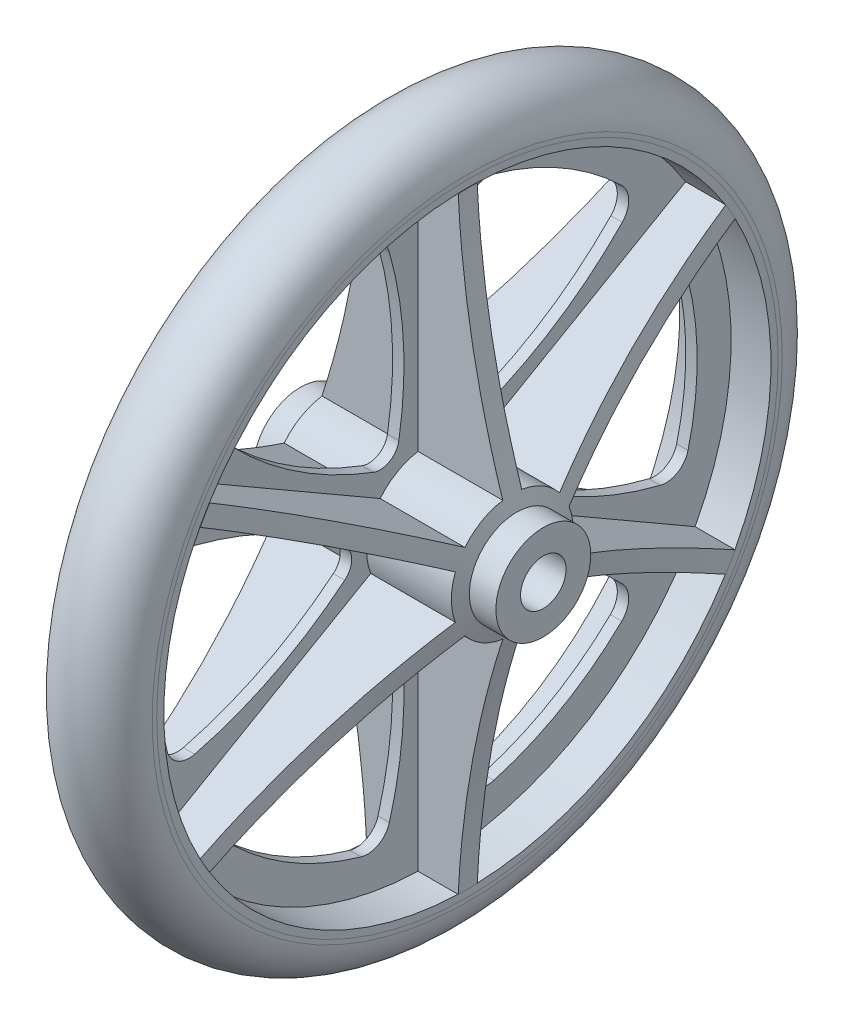
from build123d import *
from build123d.topology import SkipClean

# Parameters (mm, degrees)
SALIENTE_EXTRUIR8_DEPTH      = 32
SALIENTE_EXTRUIR8_DEPTH_BACK = 32
CROQUIS9_R                   = 16
CROQUIS9_R_2                 = 6
CROQUIS10_R                  = 16
CROQUIS10_R_2                = 12.5
CORTAR_EXTRUIR1_DEPTH        = 9
CROQUIS11_R                  = 16
CROQUIS11_R_2                = 12.5
CORTAR_EXTRUIR2_DEPTH        = 9
SALIENTE_EXTRUIR9_DEPTH      = 25
CROQUIS18_R                  = 80
SALIENTE_EXTRUIR10_DEPTH     = 1.5
CORTAR_EXTRUIR6_DEPTH        = 1.5
CORTAR_EXTRUIR5_DEPTH        = 100
CORTAR_EXTRUIR5_DEPTH_BACK   = 106
CROQUIS17_W                  = 44.792111463
CROQUIS17_H                  = 206.490346826
CROQUIS20_R                  = 6
CORTAR_EXTRUIR7_DEPTH        = 80


with BuildPart() as part:
    # Croquis1 → Revolución1 (revolve)
    with BuildSketch(Plane.XY, mode=Mode.PRIVATE) as revoluci_n1_sk:
        with BuildLine():
            Line((12, 80), (-12, 80))
            Line((-12, 80), (-12, 82))
            ThreePointArc((-12, 82), (0, 94), (12, 82))
            Line((12, 82), (12, 80))
        make_face()
    revolve(revoluci_n1_sk.sketch.rotate(Axis((0, 0, 0), (-1, 0, 0)), 90), axis=Axis((0, 0, 0), (-1, 0, 0)))



with BuildPart() as body_2:
    # Croquis9 → Saliente-Extruir8 (new, two sides: drawn at the far end of the back side and taken through both)
    with BuildSketch(Plane(origin=(0, 0, 0), x_dir=(0, 0, -1), z_dir=(1, 0, 0)).offset(-SALIENTE_EXTRUIR8_DEPTH_BACK)):
        Circle(CROQUIS9_R)
        Circle(CROQUIS9_R_2, mode=Mode.SUBTRACT)
    extrude(amount=SALIENTE_EXTRUIR8_DEPTH + SALIENTE_EXTRUIR8_DEPTH_BACK)

    # Croquis10 → Cortar-Extruir1 (cut)
    with BuildSketch(Plane(origin=(32, 0, 0), x_dir=(0, 0, -1), z_dir=(1, 0, 0))):
        Circle(CROQUIS10_R)
        Circle(CROQUIS10_R_2, mode=Mode.SUBTRACT)
    extrude(amount=-CORTAR_EXTRUIR1_DEPTH, mode=Mode.SUBTRACT)

    # Croquis11 → Cortar-Extruir2 (cut)
    with BuildSketch(Plane.ZY.offset(32)):
        with Locations(Location((0, 0, 0), (0, 0, 180))):
            Circle(CROQUIS11_R)
        with Locations(Location((0, 0, 0), (0, 0, 180))):
            Circle(CROQUIS11_R_2, mode=Mode.SUBTRACT)
    extrude(amount=-CORTAR_EXTRUIR2_DEPTH, mode=Mode.SUBTRACT)


with BuildPart() as part_1:
    add(part.part)

    add(body_2.part)  # Saliente-Extruir9 merges body 2
    # Croquis12 → Saliente-Extruir9 (add)
    with BuildSketch(Plane(origin=(0, 0, 0), x_dir=(0, 0, -1), z_dir=(1, 0, 0))):
        with BuildLine():
            ThreePointArc((70.498194922, 37.81540047), (69.282032303, 40), (67.998194922, 42.145527489))
            Line((67.998194922, 42.145527489), (12.476009193, 10.089778612))
            ThreePointArc((12.476009193, 10.089778612), (8.022693404, 13.895712589), (2.5, 15.849430205))
            Line((2.5, 15.849430205), (2.5, 79.960927959))
            ThreePointArc((2.5, 79.960927959), (0, 80), (-2.5, 79.960927959))
            Line((-2.5, 79.960927959), (-2.5, 15.849430205))
            ThreePointArc((-2.5, 15.849430205), (-8.022693404, 13.895712589), (-12.476009193, 10.089778612))
            Line((-12.476009193, 10.089778612), (-67.998194922, 42.145527489))
            ThreePointArc((-67.998194922, 42.145527489), (-69.282032303, 40), (-70.498194922, 37.81540047))
            Line((-70.498194922, 37.81540047), (-14.976009193, 5.759651593))
            ThreePointArc((-14.976009193, 5.759651593), (-16.045386808, 0), (-14.976009193, -5.759651593))
            Line((-14.976009193, -5.759651593), (-70.498194922, -37.81540047))
            ThreePointArc((-70.498194922, -37.81540047), (-69.282032303, -40), (-67.998194922, -42.145527489))
            Line((-67.998194922, -42.145527489), (-12.476009193, -10.089778612))
            ThreePointArc((-12.476009193, -10.089778612), (-8.022693404, -13.895712589), (-2.5, -15.849430205))
            Line((-2.5, -15.849430205), (-2.5, -79.960927959))
            ThreePointArc((-2.5, -79.960927959), (0, -80), (2.5, -79.960927959))
            Line((2.5, -79.960927959), (2.5, -15.849430205))
            ThreePointArc((2.5, -15.849430205), (8.022693404, -13.895712589), (12.476009193, -10.089778612))
            Line((12.476009193, -10.089778612), (67.998194922, -42.145527489))
            ThreePointArc((67.998194922, -42.145527489), (69.282032303, -40), (70.498194922, -37.81540047))
            Line((70.498194922, -37.81540047), (14.976009193, -5.759651593))
            ThreePointArc((14.976009193, -5.759651593), (16.045386808, 0), (14.976009193, 5.759651593))
            Line((14.976009193, 5.759651593), (70.498194922, 37.81540047))
        make_face()
    extrude(amount=SALIENTE_EXTRUIR9_DEPTH)

    # Croquis15 → Cortar-Revolución3 (revolve, cut)
    with BuildSketch(Plane(origin=(0, 0, 0.669872981), x_dir=(1, 0, 0), z_dir=(0, -1, 0))):
        with BuildLine():
            Line((12.957435965, -68.668067903), (25, -68.668067903))
            Line((25, -68.668067903), (25, -13.169872981))
            ThreePointArc((25, -13.169872981), (17.362483952, -40.568263508), (12.957435965, -68.668067903))
        make_face()
        with BuildLine():
            Line((25, -83.692548192), (25, -68.668067903))
            Line((25, -68.668067903), (12.957435965, -68.668067903))
            ThreePointArc((12.957435965, -68.668067903), (12.341238653, -76.172602145), (11.956342895, -83.692548192))
            Line((11.956342895, -83.692548192), (25, -83.692548192))
        make_face()
    revolve(axis=Axis((36.317823099, 0, 0), (-1, 0, 0)), mode=Mode.SUBTRACT)

    # Croquis18 → Saliente-Extruir10 (add)
    with BuildSketch(Plane(origin=(0, 0, 0), x_dir=(0, 0, -1), z_dir=(1, 0, 0))):
        Circle(CROQUIS18_R)
    extrude(amount=SALIENTE_EXTRUIR10_DEPTH)

    # Croquis19 → Cortar-Extruir6 (cut)
    with BuildSketch(Plane(origin=(1.5, 0, 0), x_dir=(0, 0, -1), z_dir=(1, 0, 0))):
        with BuildLine():
            ThreePointArc((7.56694856, 20.835157631), (10, 17.320508076), (14.26030152, 16.970748498))
            ThreePointArc((14.26030152, 16.970748498), (34.122576455, 27.054357454), (51.305621529, 41.229409383))
            ThreePointArc((51.305621529, 41.229409383), (53.001770658, 45.502031438), (51.17629136, 49.721017859))
            ThreePointArc((51.17629136, 49.721017859), (35.52529227, 61.531611165), (17.471518888, 69.180477318))
            ThreePointArc((17.471518888, 69.180477318), (12.90502982, 68.651895554), (10.052905144, 65.046676293))
            ThreePointArc((10.052905144, 65.046676293), (6.36847261, 43.07819678), (7.56694856, 20.835157631))
        make_face()
        with BuildLine():
            ThreePointArc((68.647810248, -19.459459459), (71.05058454, 0), (68.647810248, 19.459459459))
            ThreePointArc((68.647810248, 19.459459459), (65.906800478, 23.149864117), (61.358526673, 23.81726691))
            ThreePointArc((61.358526673, 23.81726691), (40.491049066, 16.023839326), (21.82725008, 3.864409133))
            ThreePointArc((21.82725008, 3.864409133), (20, 0), (21.82725008, -3.864409133))
            ThreePointArc((21.82725008, -3.864409133), (40.491049066, -16.023839326), (61.358526673, -23.81726691))
            ThreePointArc((61.358526673, -23.81726691), (65.906800478, -23.149864117), (68.647810248, -19.459459459))
        make_face()
        with BuildLine():
            ThreePointArc((17.471518888, -69.180477318), (35.52529227, -61.531611165), (51.17629136, -49.721017859))
            ThreePointArc((51.17629136, -49.721017859), (53.001770658, -45.502031438), (51.305621529, -41.229409383))
            ThreePointArc((51.305621529, -41.229409383), (34.122576455, -27.054357454), (14.26030152, -16.970748498))
            ThreePointArc((14.26030152, -16.970748498), (10, -17.320508076), (7.56694856, -20.835157631))
            ThreePointArc((7.56694856, -20.835157631), (6.36847261, -43.07819678), (10.052905144, -65.046676293))
            ThreePointArc((10.052905144, -65.046676293), (12.90502982, -68.651895554), (17.471518888, -69.180477318))
        make_face()
        with BuildLine():
            ThreePointArc((-51.17629136, -49.721017859), (-35.52529227, -61.531611165), (-17.471518888, -69.180477318))
            ThreePointArc((-17.471518888, -69.180477318), (-12.90502982, -68.651895554), (-10.052905144, -65.046676293))
            ThreePointArc((-10.052905144, -65.046676293), (-6.36847261, -43.07819678), (-7.56694856, -20.835157631))
            ThreePointArc((-7.56694856, -20.835157631), (-10, -17.320508076), (-14.26030152, -16.970748498))
            ThreePointArc((-14.26030152, -16.970748498), (-34.122576455, -27.054357454), (-51.305621529, -41.229409383))
            ThreePointArc((-51.305621529, -41.229409383), (-53.001770658, -45.502031438), (-51.17629136, -49.721017859))
        make_face()
        with BuildLine():
            ThreePointArc((-68.647810248, 19.459459459), (-71.05058454, 0), (-68.647810248, -19.459459459))
            ThreePointArc((-68.647810248, -19.459459459), (-65.906800478, -23.149864117), (-61.358526673, -23.81726691))
            ThreePointArc((-61.358526673, -23.81726691), (-40.491049066, -16.023839326), (-21.82725008, -3.864409133))
            ThreePointArc((-21.82725008, -3.864409133), (-20, 0), (-21.82725008, 3.864409133))
            ThreePointArc((-21.82725008, 3.864409133), (-40.491049066, 16.023839326), (-61.358526673, 23.81726691))
            ThreePointArc((-61.358526673, 23.81726691), (-65.906800478, 23.149864117), (-68.647810248, 19.459459459))
        make_face()
        with BuildLine():
            ThreePointArc((-17.471518888, 69.180477318), (-35.52529227, 61.531611165), (-51.17629136, 49.721017859))
            ThreePointArc((-51.17629136, 49.721017859), (-53.001770658, 45.502031438), (-51.305621529, 41.229409383))
            ThreePointArc((-51.305621529, 41.229409383), (-34.122576455, 27.054357454), (-14.26030152, 16.970748498))
            ThreePointArc((-14.26030152, 16.970748498), (-10, 17.320508076), (-7.56694856, 20.835157631))
            ThreePointArc((-7.56694856, 20.835157631), (-6.36847261, 43.07819678), (-10.052905144, 65.046676293))
            ThreePointArc((-10.052905144, 65.046676293), (-12.90502982, 68.651895554), (-17.471518888, 69.180477318))
        make_face()
    extrude(amount=-CORTAR_EXTRUIR6_DEPTH, mode=Mode.SUBTRACT)

    # Croquis17 → Cortar-Extruir5 (cut, two sides: drawn at the far end of the back side and taken through both)
    with BuildSketch(Plane.XY.offset(-CORTAR_EXTRUIR5_DEPTH_BACK)):
        with Locations((-22.396055732, 0.535641842)):
            Rectangle(CROQUIS17_W, CROQUIS17_H)
    extrude(amount=CORTAR_EXTRUIR5_DEPTH + CORTAR_EXTRUIR5_DEPTH_BACK, mode=Mode.SUBTRACT)

    # Simetría1: part across plane


with BuildPart() as part_2:
    with SkipClean():  # the faces are left unmerged after this step: merging them gives an invalid solid
        add(part_1.part)
        add(part_1.part.mirror(Plane(origin=(0, 0, 0), x_dir=(0, 0, 1), z_dir=(1, 0, 0))))

    # Croquis20 → Cortar-Extruir7 (cut)
    with SkipClean():  # the faces are left unmerged after this step: merging them gives an invalid solid
        with BuildSketch(Plane(origin=(25, 0, 0), x_dir=(0, 0, -1), z_dir=(1, 0, 0))):
            Circle(CROQUIS20_R)
        extrude(amount=-CORTAR_EXTRUIR7_DEPTH, mode=Mode.SUBTRACT)


solid = part_2.part
